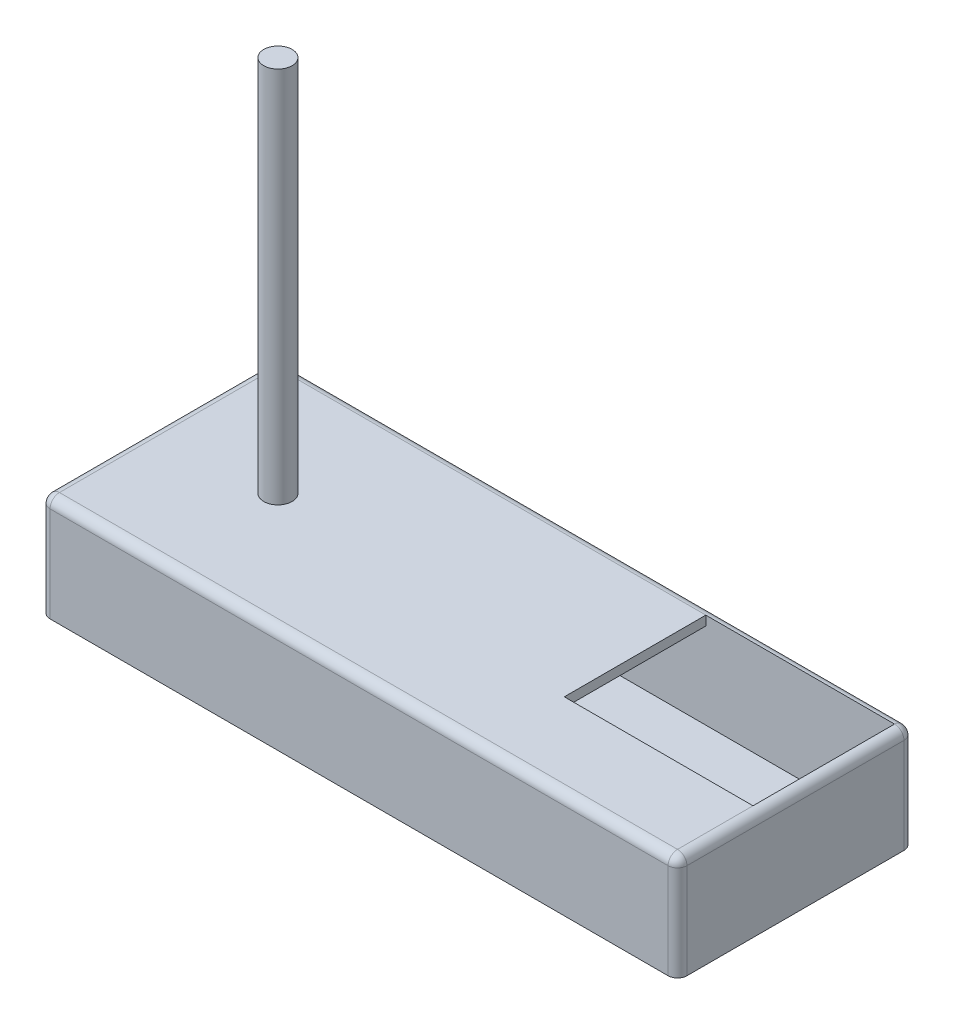
from build123d import *

# Parameters (mm, degrees)
SKETCH1_W           = 171.45
SKETCH1_H           = 63.5
BOSS_EXTRUDE1_DEPTH = 28.194
SHELL1_T            = 2.54
FILLET1_R           = 2.54
FILLET2_R           = 2.54
FILLET3_R           = 2.54
FILLET4_R           = 2.54
CUT_EXTRUDE4_REACH  = 97.665
SKETCH7_W           = 50.8
SKETCH7_H           = 38.1
SKETCH13_R          = 3.81
BOSS_EXTRUDE3_DEPTH = 101.6
CUT_EXTRUDE8_REACH  = 219.37
SKETCH24_W          = 58.42
SKETCH24_H          = 22.874339667


with BuildPart() as part:
    # Sketch1 → Boss-Extrude1 (new body)
    with BuildSketch(Plane(origin=(0, 0, 0), x_dir=(1, 0, 0), z_dir=(0, 1, 0))):
        Rectangle(SKETCH1_W, SKETCH1_H)
    extrude(amount=BOSS_EXTRUDE1_DEPTH)

    # Shell1 (no face opened: a closed hollow body)
    add(offset(amount=-SHELL1_T, mode=Mode.PRIVATE), mode=Mode.SUBTRACT)

    # Fillet1
    fillet1_edges = [part.edges().sort_by_distance(p)[0] for p in [
        (0, 28.194, -31.75),
    ]]
    fillet(fillet1_edges, radius=FILLET1_R)

    # Fillet2
    fillet2_edges = [part.edges().sort_by_distance(p)[0] for p in [
        (0, 28.194, 31.75),
    ]]
    fillet(fillet2_edges, radius=FILLET2_R)

    # Fillet3
    fillet3_edges = [part.edges().sort_by_distance(p)[0] for p in [
        (-85.725, 28.194, 0),
        (-85.725, 12.827, -31.75),
        (-85.725, 27.450051224, -31.006051224),
        (-85.725, 12.827, 31.75),
        (-85.725, 27.450051224, 31.006051224),
    ]]
    fillet(fillet3_edges, radius=FILLET3_R)

    # Fillet4
    fillet4_edges = [part.edges().sort_by_distance(p)[0] for p in [
        (85.725, 12.827, -31.75),
        (85.725, 27.450051224, -31.006051224),
        (85.725, 28.194, 0),
        (85.725, 12.827, 31.75),
        (85.725, 27.450051224, 31.006051224),
    ]]
    fillet(fillet4_edges, radius=FILLET4_R)

    # Sketch7 → Cut-Extrude4 (cut, up to next)
    with BuildSketch(Plane(origin=(0, 28.194, 0), x_dir=(1, 0, 0), z_dir=(0, 1, 0)), mode=Mode.PRIVATE) as cut_extrude4_sk1:
        with Locations((57.785, 10.16)):
            Rectangle(SKETCH7_W, SKETCH7_H)
    cut_extrude4_tool1 = extrude(cut_extrude4_sk1.sketch, amount=-CUT_EXTRUDE4_REACH, mode=Mode.PRIVATE) & part.part
    add(cut_extrude4_tool1.solids().sort_by_distance((57.785, 28.194, -10.16))[0], mode=Mode.SUBTRACT)

    # Sketch13 → Boss-Extrude3 (add)
    with BuildSketch(Plane(origin=(0, 28.194, 0), x_dir=(1, 0, 0), z_dir=(0, 1, 0))):
        with Locations(Location((-53.579839064, 0, 0), (0, 0, 90))):
            Circle(SKETCH13_R)
    extrude(amount=BOSS_EXTRUDE3_DEPTH)

    # Sketch24 → Cut-Extrude8 (cut, up to next)
    with BuildSketch(Plane.ZY.offset(85.725), mode=Mode.PRIVATE) as cut_extrude8_sk1:
        with Locations((0, 14.216830166)):
            Rectangle(SKETCH24_W, SKETCH24_H)
    cut_extrude8_tool1 = extrude(cut_extrude8_sk1.sketch, amount=-CUT_EXTRUDE8_REACH, mode=Mode.PRIVATE) & part.part
    add(cut_extrude8_tool1.solids().sort_by_distance((-85.725, 14.21683, 0))[0], mode=Mode.SUBTRACT)


solid = part.part
